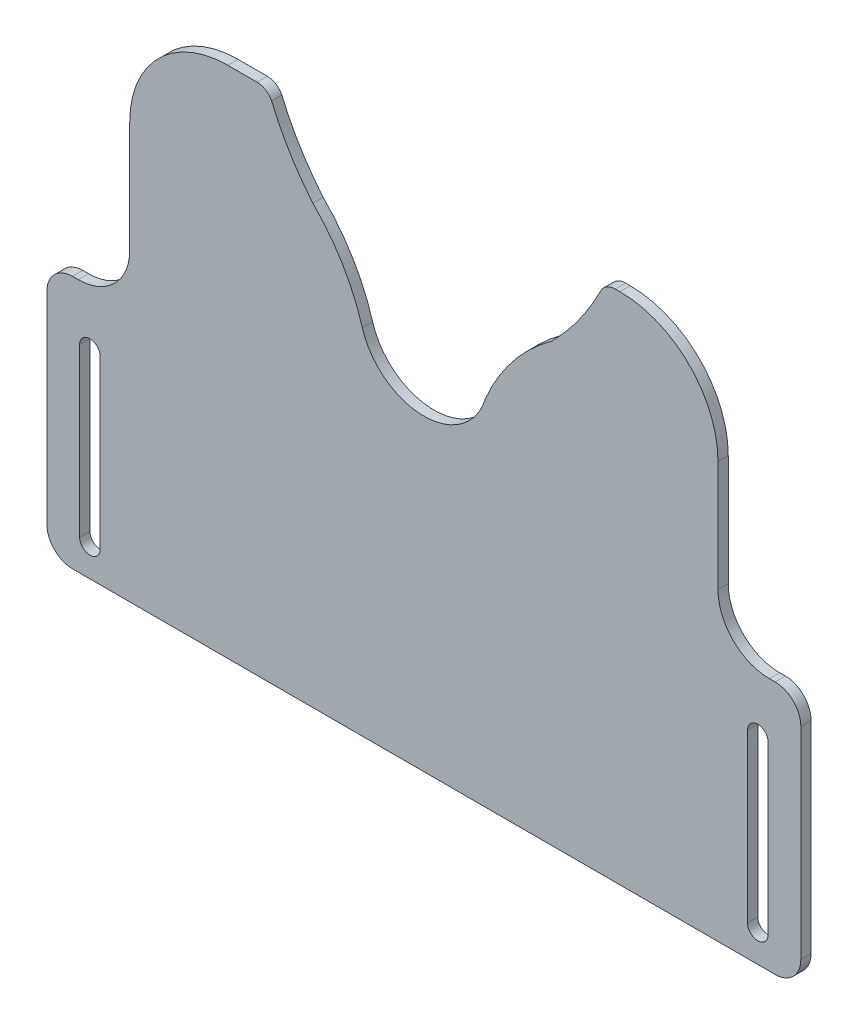
from build123d import *

# Parameters (mm, degrees)
BOSS_EXTRUDE1_DEPTH = 4
SKETCH3_W           = 32.247348798
SKETCH3_H           = 98.634443856
BOSS_EXTRUDE2_DEPTH = 4
FILLET1_R           = 10
FILLET2_R           = 20


with BuildPart() as part:
    # Sketch2 → Boss-Extrude1 (new body)
    with BuildSketch(Plane.XY):
        with BuildLine():
            Line((76.333327253, 193.365556144), (74.505250646, 193.365556144))
            ThreePointArc((74.505250646, 193.365556144), (71.161018329, 192.415530393), (68.815701693, 189.849223982))
            ThreePointArc((68.815701693, 189.849223982), (60.349326569, 175.855147798), (49.750675278, 163.39793034))
            ThreePointArc((49.750675278, 163.39793034), (34.635352262, 149.04171936), (23.967616463, 131.131577079))
            ThreePointArc((23.967616463, 131.131577079), (-2.91e-07, 113.241661662), (-23.967618369, 131.131575305))
            ThreePointArc((-23.967618369, 131.131575305), (-31.555288195, 148.464095417), (-43.172927111, 163.397931257))
            ThreePointArc((-43.172927111, 163.397931257), (-52.235367622, 176.00763771), (-59.274047079, 189.849224193))
            ThreePointArc((-59.274047079, 189.849224193), (-61.61936371, 192.415530455), (-64.963595927, 193.365556144))
            Line((-64.963595927, 193.365556144), (-76.333338023, 193.365556144))
            ThreePointArc((-76.333338023, 193.365556144), (-103.321247, 182.186797795), (-114.500004355, 155.198888406))
            Line((-114.500004355, 155.198888406), (-114.500004355, -6.634443856))
            Line((-114.500004355, -6.634443856), (114.49999565, -6.634443856))
            Line((114.49999565, -6.634443856), (114.49999565, 155.198890546))
            ThreePointArc((114.49999565, 155.198890546), (103.321236808, 182.186799282), (76.333327253, 193.365556144))
        make_face()
    extrude(amount=BOSS_EXTRUDE1_DEPTH)


with BuildPart() as boss_extrude2_tool:
    # Sketch3 → Boss-Extrude2 (new body)
    # profile 1 of 2: a face of its own
    with BuildSketch(Plane.XY.offset(4)):
        with Locations((-130.623678754, 42.682778072)):
            Rectangle(SKETCH3_W, SKETCH3_H)
        with BuildLine():
            Line((-125.999999998, 70.365556144), (-125.999999998, 5.365556144))
            ThreePointArc((-125.999999998, 5.365556144), (-129.999999998, 1.365556144), (-133.999999998, 5.365556144))
            Line((-133.999999998, 5.365556144), (-133.999999998, 70.365556144))
            ThreePointArc((-133.999999998, 70.365556144), (-129.999999998, 74.365556144), (-125.999999998, 70.365556144))
        make_face(mode=Mode.SUBTRACT)
    # profile 2 of 2: a face of its own
    with BuildSketch(Plane.XY.offset(4)):
        Polygon((114.500004355, 92), (114.49999565, -6.634443856), (146.747353153, -6.634443856), (146.747353153, 92), align=None)
        with BuildLine():
            Line((125.999999998, 70.365556144), (125.999999998, 5.365556144))
            ThreePointArc((125.999999998, 5.365556144), (129.999999998, 1.365556144), (133.999999998, 5.365556144))
            Line((133.999999998, 5.365556144), (133.999999998, 70.365556144))
            ThreePointArc((133.999999998, 70.365556144), (129.999999998, 74.365556144), (125.999999998, 70.365556144))
        make_face(mode=Mode.SUBTRACT)
    extrude(amount=-BOSS_EXTRUDE2_DEPTH)


with BuildPart() as part_1:
    add(part.part)


with BuildPart() as part_2:
    # Boss-Extrude2: joined with boss_extrude2_tool
    add(part_1.part.fuse(boss_extrude2_tool.part, tol=0.00001))

    # Fillet1
    fillet1_edges = [part_2.edges().sort_by_distance(p)[0] for p in [
        (146.747353153, 92, 2),
        (146.747353153, -6.634443856, 2),
        (-146.747353153, -6.634443856, 2),
        (-146.747353153, 92, 2),
    ]]
    fillet(fillet1_edges, radius=FILLET1_R)

    # Fillet2
    fillet2_edges = [part_2.edges().sort_by_distance(p)[0] for p in [
        (-114.500004355, 92, 2),
        (114.500004355, 92, 2),
    ]]
    fillet(fillet2_edges, radius=FILLET2_R)


solid = part_2.part
